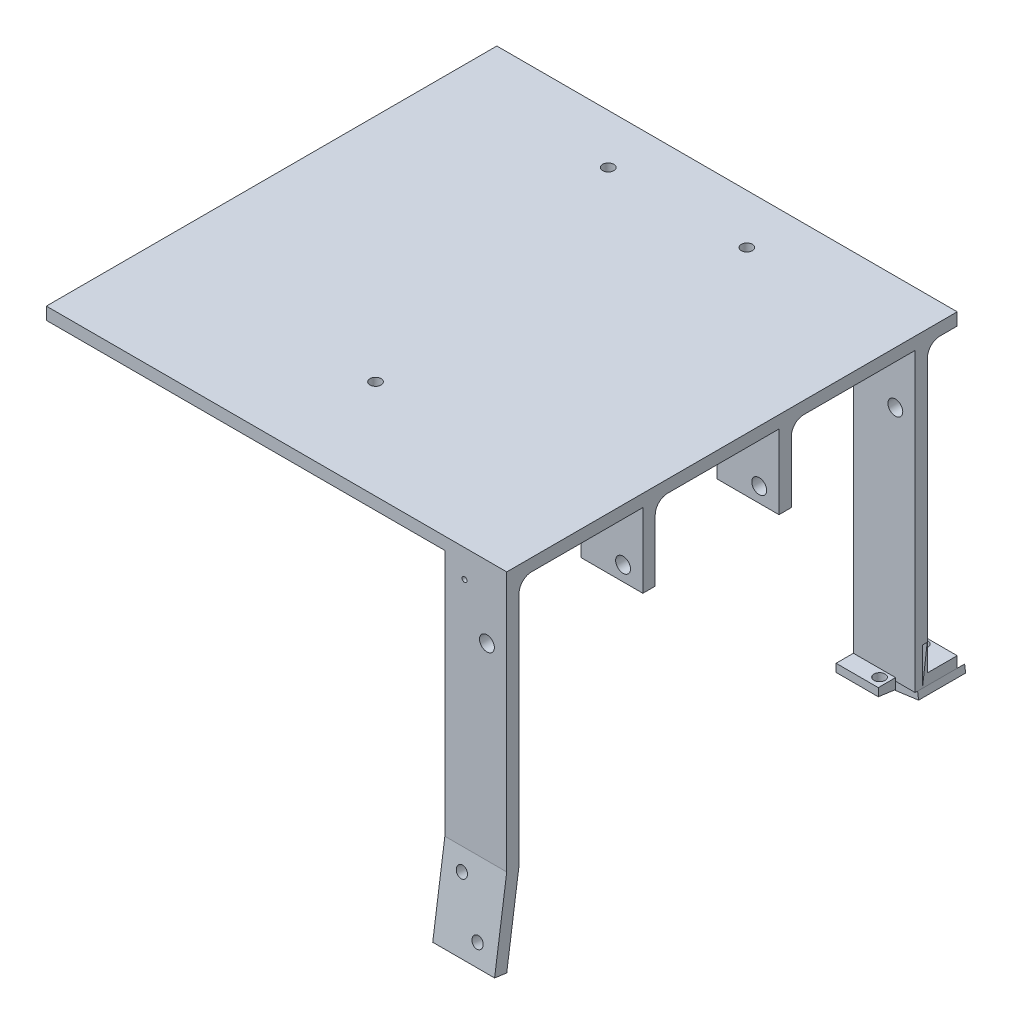
from build123d import *

# Parameters (mm, degrees)
BOSS_EXTRUDE1_DEPTH      = 5
SKETCH2_W                = 5
SKETCH2_H                = 22.5
BOSS_EXTRUDE2_DEPTH      = 38
SKETCH5_W                = 25
SKETCH5_H                = 5
BOSS_EXTRUDE3_DEPTH      = 30
FILLET3_R                = 5
SKETCH6_R                = 3
CUT_EXTRUDE4_DEPTH       = 172
SKETCH7_W                = 5
SKETCH7_H                = 22.5
BOSS_EXTRUDE4_DEPTH      = 51.5
SKETCH3_R                = 1.3
CUT_EXTRUDE2_DEPTH       = 357.71872673
SKETCH9_W                = 116
SKETCH9_H                = 63.779574991
CUT_EXTRUDE6_DEPTH       = 10
SKETCH10_W               = 25
SKETCH10_H               = 5
BOSS_EXTRUDE5_DEPTH      = 70
BOSS_EXTRUDE6_DEPTH      = 25
SKETCH12_W               = 25
SKETCH12_H               = 5
BOSS_EXTRUDE7_DEPTH      = 19.72
BOSS_EXTRUDE8_DEPTH      = 15
BOSS_EXTRUDE8_DEPTH_BACK = 4
CUT_EXTRUDE7_DEPTH       = 15
SKETCH15_R               = 2.25
CUT_EXTRUDE8_DEPTH       = 20
SKETCH16_W               = 6
SKETCH16_H               = 3
BOSS_EXTRUDE9_DEPTH      = 12.4
SKETCH17_R               = 1
CUT_EXTRUDE9_DEPTH       = 282.347152812
SKETCH27_W               = 25.232191294
SKETCH27_H               = 19
BOSS_EXTRUDE11_DEPTH     = 3
FILLET4_R                = 5
SKETCH18_R               = 2.25
CUT_EXTRUDE10_DEPTH      = 378.078044336
SKETCH19_W               = 4.5
SKETCH19_H               = 6
CUT_EXTRUDE12_DEPTH      = 383.13686347
FILLET6_R                = 10
SKETCH21_W               = 27
SKETCH21_H               = 70
CUT_EXTRUDE14_DEPTH      = 383.13686347
FILLET7_R                = 10
FILLET8_R                = 2.5
SKETCH22_R               = 2.25
CUT_EXTRUDE16_DEPTH      = 10
SKETCH23_W               = 17.043474802
SKETCH23_H               = 5.138762975
BOSS_EXTRUDE10_DEPTH     = 7
CUT_EXTRUDE17_REACH      = 372.436
CUT_EXTRUDE18_REACH      = 380.086
SKETCH25_R               = 2.25
SKETCH28_R               = 2.25
CUT_EXTRUDE19_DEPTH      = 384.936136276
CUT_EXTRUDE20_DEPTH      = 126
CUT_EXTRUDE20_DEPTH_BACK = 10
SKETCH29_W               = 186
SKETCH29_H               = 118
SKETCH30_R               = 2.25
CUT_EXTRUDE21_DEPTH      = 383.13686347


with BuildPart() as part:
    # Sketch1 → Boss-Extrude1 (new body)
    with BuildSketch(Plane(origin=(0, 0, 0), x_dir=(1, 0, 0), z_dir=(0, 1, 0))):
        Polygon((0, 0), (0, -300), (186, -300), (186, 0), (176, 0), (151, 0), (151, -56.115865257), (35, -56.115865257), (35, 0), (10, 0), align=None)
    extrude(amount=BOSS_EXTRUDE1_DEPTH)

    # Sketch2 → Boss-Extrude2 (add)
    with BuildSketch(Plane.XZ):
        with Locations((53, 82.75)):
            Rectangle(SKETCH2_W, SKETCH2_H)
        with Locations((133, 82.75)):
            Rectangle(SKETCH2_W, SKETCH2_H)
    extrude(amount=BOSS_EXTRUDE2_DEPTH)

    # Sketch5 → Boss-Extrude3 (add)
    with BuildSketch(Plane.XZ):
        with Locations((173.5, 297.5)):
            Rectangle(SKETCH5_W, SKETCH5_H)
        with Locations((173.5, 242.5)):
            Rectangle(SKETCH5_W, SKETCH5_H)
        with Locations((173.5, 187.5)):
            Rectangle(SKETCH5_W, SKETCH5_H)
        with Locations((173.5, 132.5)):
            Rectangle(SKETCH5_W, SKETCH5_H)
    extrude(amount=BOSS_EXTRUDE3_DEPTH)

    # Fillet3
    fillet3_edges = [part.edges().sort_by_distance(p)[0] for p in [
        (173.5, 0, 295),
        (173.5, 0, 240),
        (173.5, 0, 185),
        (173.5, 0, 130),
    ]]
    fillet(fillet3_edges, radius=FILLET3_R)

    # Sketch6 → Cut-Extrude4 (cut)
    with BuildSketch(Plane.XY.offset(300)):
        with Locations((178, -24)):
            Circle(SKETCH6_R)
    extrude(amount=-CUT_EXTRUDE4_DEPTH, mode=Mode.SUBTRACT)

    # Sketch7 → Boss-Extrude4 (add)
    with BuildSketch(Plane.XZ):
        with Locations((2.5, 11.25)):
            Rectangle(SKETCH7_W, SKETCH7_H)
        with Locations((183.5, 11.25)):
            Rectangle(SKETCH7_W, SKETCH7_H)
    extrude(amount=BOSS_EXTRUDE4_DEPTH)

    # Sketch3 → Cut-Extrude2 (cut, through all)
    with BuildSketch(Plane(origin=(186, 0, 0), x_dir=(0, 0, -1), z_dir=(1, 0, 0))):
        with Locations((-74, -32.9)):
            Circle(SKETCH3_R)
        with Locations((-91.5, -32.9)):
            Circle(SKETCH3_R)
        with Locations((-20, -46.4)):
            Circle(SKETCH3_R)
        with Locations((-2.5, -46.4)):
            Circle(SKETCH3_R)
    extrude(amount=-CUT_EXTRUDE2_DEPTH, mode=Mode.SUBTRACT)

    # Sketch9 → Cut-Extrude6 (cut)
    with BuildSketch(Plane.XZ):
        with Locations((93, 31.889787496)):
            Rectangle(SKETCH9_W, SKETCH9_H)
    extrude(amount=-CUT_EXTRUDE6_DEPTH, mode=Mode.SUBTRACT)

    # Sketch10 → Boss-Extrude5 (add)
    with BuildSketch(Plane.XZ.offset(30)):
        with Locations((173.5, 297.5)):
            Rectangle(SKETCH10_W, SKETCH10_H)
        with Locations((173.5, 132.5)):
            Rectangle(SKETCH10_W, SKETCH10_H)
    extrude(amount=BOSS_EXTRUDE5_DEPTH)

    # Sketch11 → Boss-Extrude6 (add)
    with BuildSketch(Plane(origin=(186, 0, 0), x_dir=(0, 0, -1), z_dir=(1, 0, 0))):
        Polygon((-300, -100), (-304.901863346, -134.643852153), (-300, -135.337431613), (-295, -100), align=None)
    extrude(amount=-BOSS_EXTRUDE6_DEPTH)

    # Sketch12 → Boss-Extrude7 (add)
    with BuildSketch(Plane.XZ.offset(100)):
        with Locations((173.5, 132.5)):
            Rectangle(SKETCH12_W, SKETCH12_H)
    extrude(amount=BOSS_EXTRUDE7_DEPTH)

    # Sketch13 → Boss-Extrude8 (add, two sides: drawn at the far end of the back side and taken through both)
    with BuildSketch(Plane(origin=(0, 0, 130), x_dir=(-1, 0, 0), z_dir=(0, 0, -1)).offset(-BOSS_EXTRUDE8_DEPTH_BACK)):
        Polygon((-186, -115.314128401), (-186, -119.72), (-161, -123.135183378), (-161, -115.314128401), align=None)
    extrude(amount=BOSS_EXTRUDE8_DEPTH + BOSS_EXTRUDE8_DEPTH_BACK)

    # Sketch14 → Cut-Extrude7 (cut)
    with BuildSketch(Plane(origin=(19.462480736, -142.470246704, 0), x_dir=(0.9907978149243063, 0.1353502491361595, 0), z_dir=(0.1353502491361595, -0.9907978149243063, 0))):
        Polygon((186.357631366, 115), (168.084261749, 132.037436989), (198.015187573, 130.430954629), (197.515117956, 111.366582762), (186.357631366, 109.607523038), align=None)
    extrude(amount=-CUT_EXTRUDE7_DEPTH, mode=Mode.SUBTRACT)

    # Sketch15 → Cut-Extrude8 (cut)
    with BuildSketch(Plane(origin=(0, 39.65203451, 280.240211564), x_dir=(1, 0, 0), z_dir=(0, 0.14009757598944012, 0.9901377021414158))):
        with Locations(Location((178, -168.031966348, 0), (0, 0, 270))):
            Circle(SKETCH15_R)
        with Locations(Location((169, -149.043043011, 0), (0, 0, 270))):
            Circle(SKETCH15_R)
    extrude(amount=-CUT_EXTRUDE8_DEPTH, mode=Mode.SUBTRACT)

    # Sketch16 → Boss-Extrude9 (add)
    with BuildSketch(Plane.XZ):
        with Locations((169, 273.5)):
            Rectangle(SKETCH16_W, SKETCH16_H)
        with Locations((140.4, 273.5)):
            Rectangle(SKETCH16_W, SKETCH16_H)
        with Locations((169, 218.5)):
            Rectangle(SKETCH16_W, SKETCH16_H)
        with Locations((169, 163.5)):
            Rectangle(SKETCH16_W, SKETCH16_H)
        with Locations((140.4, 218.5)):
            Rectangle(SKETCH16_W, SKETCH16_H)
        with Locations((140.4, 163.5)):
            Rectangle(SKETCH16_W, SKETCH16_H)
    extrude(amount=BOSS_EXTRUDE9_DEPTH)

    # Sketch17 → Cut-Extrude9 (cut, through all)
    with BuildSketch(Plane(origin=(0, 0, 162), x_dir=(-1, 0, 0), z_dir=(0, 0, -1))):
        with BuildLine():
            ThreePointArc((-169.75, -5.6), (-169.95, -6.2), (-169.75, -6.8))
            ThreePointArc((-169.75, -6.8), (-168.633772234, -7.148683298), (-167.95, -6.2))
            ThreePointArc((-167.95, -6.2), (-168.633772234, -5.251316702), (-169.75, -5.6))
        make_face()
        with Locations((-140.45, -6.2)):
            Circle(SKETCH17_R)
    extrude(amount=-CUT_EXTRUDE9_DEPTH, mode=Mode.SUBTRACT)

    # Sketch27 → Boss-Extrude11 (add)
    with BuildSketch(Plane(origin=(19.462480736, -142.470246704, 0), x_dir=(0.9907978149243063, 0.1353502491361595, 0), z_dir=(0.1353502491361595, -0.9907978149243063, 0))):
        with Locations((155.468166102, 124.5)):
            Rectangle(SKETCH27_W, SKETCH27_H)
    extrude(amount=BOSS_EXTRUDE11_DEPTH)

    # Fillet4
    fillet4_edges = [part.edges().sort_by_distance(p)[0] for p in [
        (140.4, 0, 220),
        (169, 0, 165),
        (169, 0, 220),
        (140.4, 0, 275),
        (140.4, 0, 165),
        (169, 0, 275),
    ]]
    fillet(fillet4_edges, radius=FILLET4_R)

    # Sketch18 → Cut-Extrude10 (cut, through all)
    with BuildSketch(Plane(origin=(0, -115.314128401, 0), x_dir=(1, 0, 0), z_dir=(0, 1, 0))):
        with Locations(Location((174.885718372, -120.99470656, 0), (0, 0, 180))):
            Circle(SKETCH18_R)
    extrude(amount=-CUT_EXTRUDE10_DEPTH, mode=Mode.SUBTRACT)

    # Sketch19 → Cut-Extrude12 (cut, through all)
    with BuildSketch(Plane.XZ):
        with Locations((144.95, 82.75)):
            Rectangle(SKETCH19_W, SKETCH19_H)
        with Locations((41.05, 82.75)):
            Rectangle(SKETCH19_W, SKETCH19_H)
    extrude(amount=-CUT_EXTRUDE12_DEPTH, mode=Mode.SUBTRACT)

    # Fillet6
    fillet6_edges = [part.edges().sort_by_distance(p)[0] for p in [
        (35, 2.5, 63.779574991),
        (151, 2.5, 63.779574991),
    ]]
    fillet(fillet6_edges, radius=FILLET6_R)

    # Sketch21 → Cut-Extrude14 (cut, through all)
    with BuildSketch(Plane.XZ):
        with Locations((13.5, 83)):
            Rectangle(SKETCH21_W, SKETCH21_H)
        with Locations((172.5, 83)):
            Rectangle(SKETCH21_W, SKETCH21_H)
    extrude(amount=-CUT_EXTRUDE14_DEPTH, mode=Mode.SUBTRACT)

    # Fillet7
    fillet7_edges = [part.edges().sort_by_distance(p)[0] for p in [
        (27, 2.5, 118),
        (27, 2.5, 48),
        (159, 2.5, 48),
        (159, 2.5, 118),
    ]]
    fillet(fillet7_edges, radius=FILLET7_R)

    # Fillet8
    fillet8_edges = [part.edges().sort_by_distance(p)[0] for p in [
        (55.5, 0, 82.75),
        (130.5, 0, 82.75),
    ]]
    fillet(fillet8_edges, radius=FILLET8_R)

    # Sketch22 → Cut-Extrude16 (cut)
    with BuildSketch(Plane.XZ):
        with Locations(Location((123, 76.044790491, 0), (0, 0, 270))):
            Circle(SKETCH22_R)
        with Locations(Location((63, 76.044790491, 0), (0, 0, 270))):
            Circle(SKETCH22_R)
        with Locations(Location((24.5, 25.25, 0), (0, 0, 270))):
            Circle(SKETCH22_R)
        with Locations(Location((161.5, 25.617459027, 0), (0, 0, 270))):
            Circle(SKETCH22_R)
    extrude(amount=-CUT_EXTRUDE16_DEPTH, mode=Mode.SUBTRACT)

    # Sketch23 → Boss-Extrude10 (add)
    with BuildSketch(Plane.XY.offset(135)):
        with Locations((169.584553608, -121.006176699)):
            Rectangle(SKETCH23_W, SKETCH23_H)
    extrude(amount=BOSS_EXTRUDE10_DEPTH)

    # Sketch24 → Cut-Extrude17 (cut, up to next)
    with BuildSketch(Plane.ZY.offset(-161.062816207), mode=Mode.PRIVATE) as cut_extrude17_sk1:
        Polygon((142, -121.648432415), (135, -122.638883571), (134.714975443, -124.33810847), (142, -124.33810847), align=None)
    cut_extrude17_tool1 = extrude(cut_extrude17_sk1.sketch, amount=-CUT_EXTRUDE17_REACH, mode=Mode.PRIVATE) & part.part
    add(cut_extrude17_tool1.solids().sort_by_distance((161.062816, -123.230784, 138.703404))[0], mode=Mode.SUBTRACT)

    # Cut-Extrude18: up to this plane
    cut_extrude18_end = Plane(origin=(186.407050747, -121.648432415, 142), z_dir=(0, 0.9901377021414159, -0.1400975759894394))
    # Sketch25 → Cut-Extrude18 (cut, up to the surface)
    with BuildSketch(Plane(origin=(0, -118.436795211, 0), x_dir=(1, 0, 0), z_dir=(0, 1, 0)), mode=Mode.PRIVATE) as cut_extrude18_sk1:
        with Locations(Location((174.719138996, -138.089405518, 0), (0, 0, 270))):
            Circle(SKETCH25_R)
    cut_extrude18_tool1 = split(extrude(cut_extrude18_sk1.sketch, amount=-CUT_EXTRUDE18_REACH, mode=Mode.PRIVATE), bisect_by=cut_extrude18_end, keep=Keep.BOTH, mode=Mode.PRIVATE)
    add(cut_extrude18_tool1.solids().sort_by_distance((174.719139, -118.436795, 138.089406))[0], mode=Mode.SUBTRACT)

    # Sketch28 → Cut-Extrude19 (cut, through all)
    with BuildSketch(Plane(origin=(0, 5, 0), x_dir=(1, 0, 0), z_dir=(0, 1, 0))):
        with Locations(Location((93, -260, 0), (0, 0, 270))):
            Circle(SKETCH28_R)
    extrude(amount=-CUT_EXTRUDE19_DEPTH, mode=Mode.SUBTRACT)

    # Sketch29 → Cut-Extrude20 (cut, two sides: drawn at the far end of the back side and taken through both)
    with BuildSketch(Plane.XZ.offset(-CUT_EXTRUDE20_DEPTH_BACK)):
        with Locations((93, 59)):
            Rectangle(SKETCH29_W, SKETCH29_H)
    extrude(amount=CUT_EXTRUDE20_DEPTH + CUT_EXTRUDE20_DEPTH_BACK, mode=Mode.SUBTRACT)

    # Sketch30 → Cut-Extrude21 (cut, through all)
    with BuildSketch(Plane.XZ):
        with Locations(Location((65, 138, 0), (0, 0, 270))):
            Circle(SKETCH30_R)
        with Locations(Location((121, 138, 0), (0, 0, 270))):
            Circle(SKETCH30_R)
    extrude(amount=-CUT_EXTRUDE21_DEPTH, mode=Mode.SUBTRACT)


solid = part.part
